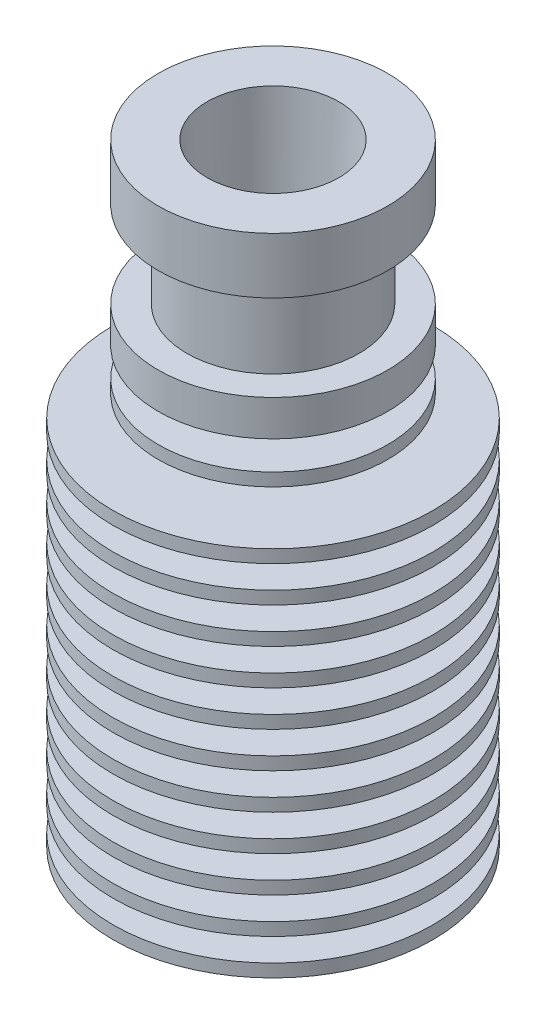
from build123d import *

# Parameters (mm, degrees)
M7X1_0_1_D               = 6
M7X1_0_1_DEPTH           = 15
SKETCH_6_R               = 1
CUT_EXTRUDE_1_DEPTH      = 15
CUT_EXTRUDE_2_DEPTH      = 46.518512717
CUT_EXTRUDE_2_DEPTH_BACK = 46.518512717
SKETCH_8_R               = 4


with BuildPart() as part:
    # 草图1 → 旋转1 (revolve)
    with BuildSketch(Plane.XY, mode=Mode.PRIVATE) as revolve_1_sk:
        Polygon((0, 0), (11.15, 0), (11.15, 0.9), (7, 0.9), (7, 2.5), (11.15, 2.5), (11.15, 3.4), (6.5, 3.4), (6.5, 5), (11.15, 5), (11.15, 5.9), (6.3, 5.9), (6.3, 7.5), (11.15, 7.5), (11.15, 8.4), (6.1, 8.4), (6.1, 10), (11.15, 10), (11.15, 10.9), (5.9, 10.9), (5.9, 12.5), (11.15, 12.5), (11.15, 13.4), (5.7, 13.4), (5.7, 15), (11.15, 15), (11.15, 15.9), (5.5, 15.9), (5.5, 17.5), (11.15, 17.5), (11.15, 18.4), (5.3, 18.4), (5.3, 20), (11.15, 20), (11.15, 20.9), (5.1, 20.9), (5.1, 22.5), (11.15, 22.5), (11.15, 23.4), (4.9, 23.4), (4.9, 25), (11.15, 25), (11.15, 25.9), (4.7, 25.9), (4.7, 27.4), (8, 27.4), (8, 28.3), (4.5, 28.3), (4.5, 30.3), (8, 30.3), (8, 32.8), (6, 32.8), (6, 38.8), (8, 38.8), (8, 42.7), (0, 42.7), align=None)
    revolve(revolve_1_sk.sketch.rotate(Axis((0, 42.7, 0), (0, -1, 0)), 180), axis=Axis((0, 42.7, 0), (0, -1, 0)))

    # 草图2 → 1/8 Rc 螺纹孔1 (revolve, cut)
    with BuildSketch(Plane(origin=(0, 42.7, 0), x_dir=(0, 0, 1), z_dir=(1, 0, 0))):
        Polygon((0, 0), (0, 11.373399445), (3.95, 9), (3.95, 8), (4.342497031, 8), (4.59223, 0), align=None)
    revolve(axis=Axis((0, 49.05, 0), (0, -1, 0)), mode=Mode.SUBTRACT)

    # M7x1.0 螺纹孔1
    with Locations(Plane(origin=(0, 0, 0), x_dir=(-1, 0, 0), z_dir=(0, -1, 0))):
        with Locations((0, 0)):
            Hole(M7X1_0_1_D / 2, depth=M7X1_0_1_DEPTH)

    # 草图6 → 切除-拉伸1 (cut)
    with BuildSketch(Plane.XZ.offset(-15)):
        with Locations(Location((0, 0, 0), (0, 0, 270))):
            Circle(SKETCH_6_R)
    extrude(amount=-CUT_EXTRUDE_1_DEPTH, mode=Mode.SUBTRACT)

    # 草图8 → 切除-拉伸2 (cut, two sides: drawn at the far end of the back side and taken through both)
    with BuildSketch(Plane(origin=(0, 42.7, 0), x_dir=(1, 0, 0), z_dir=(0, 1, 0)).offset(-CUT_EXTRUDE_2_DEPTH_BACK)):
        with Locations(Location((0, 0, 0), (0, 0, 180))):
            Circle(SKETCH_8_R)
    extrude(amount=CUT_EXTRUDE_2_DEPTH + CUT_EXTRUDE_2_DEPTH_BACK, mode=Mode.SUBTRACT)


solid = part.part
